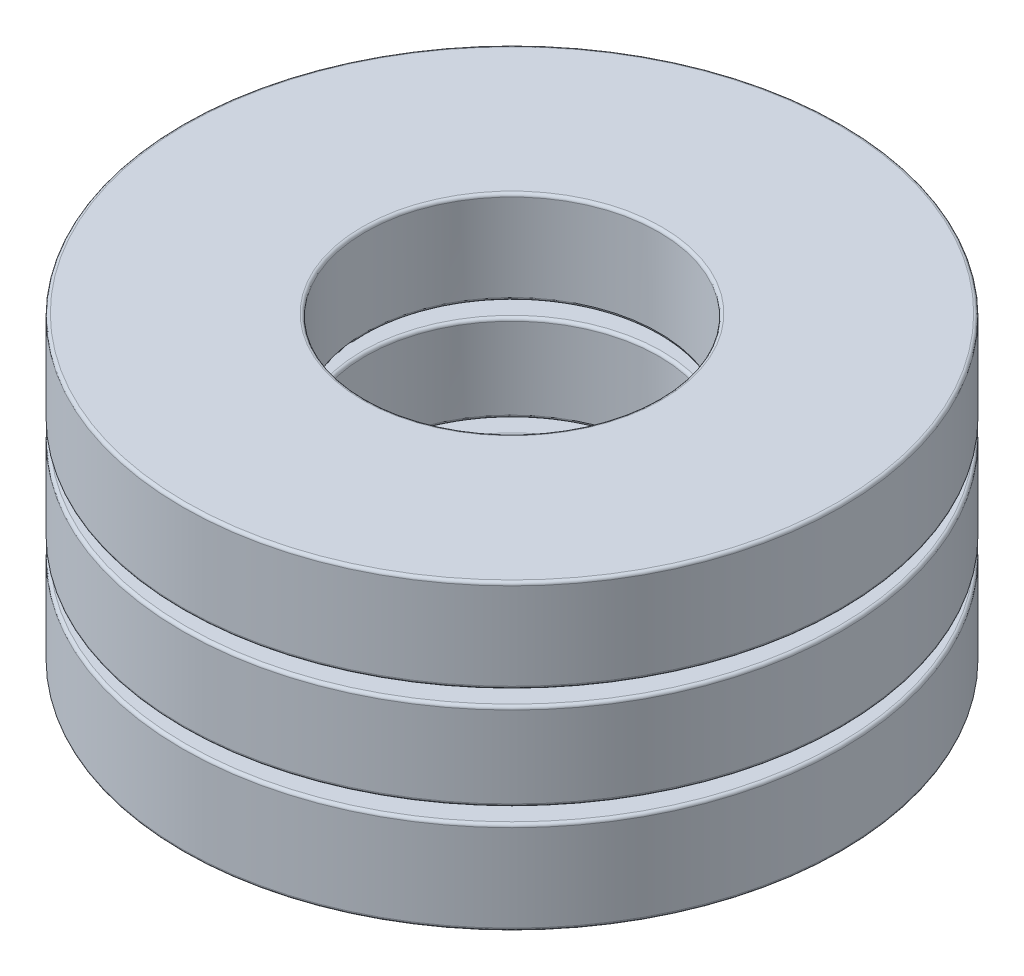
from build123d import *

# Parameters (mm, degrees)
SKETCH3_W         = 2.495
SKETCH3_H         = 1.1925
CIRPATTERN1_COUNT = 6
CIRPATTERN1_ANGLE = 300
CIRPATTERN2_COUNT = 6
SKETCH6_W         = 2.495
SKETCH6_H         = 1.27
FILLET1_R         = 0.0413
FILLET2_R         = 0.0413
FILLET3_R         = 0.0413


with BuildPart() as part:
    # Sketch3 → Revolve1 (revolve)
    with BuildSketch(Plane.XY, mode=Mode.PRIVATE) as revolve1_sk:
        with Locations((3.2525, 0)):
            Rectangle(SKETCH3_W, SKETCH3_H)
    revolve(revolve1_sk.sketch.rotate(Axis((0, 2.065, 0), (0, -1, 0)), 90), axis=Axis((0, 2.065, 0), (0, -1, 0)))

    # Sketch4 → Cut-Revolve1 (revolve, cut)
    with BuildSketch(Plane.XY):
        with BuildLine():
            Line((3.25, 0.795), (3.25, -0.795))
            ThreePointArc((3.25, -0.795), (2.455, 0), (3.25, 0.795))
        make_face()
    cut_revolve1 = revolve(axis=Axis((3.25, 0.795, 0), (0, -1, 0)), mode=Mode.SUBTRACT)

    # CirPattern2: Cut-Revolve1 ×6 about axis
    cirpattern2_axis = Axis((0, 0, 0), (0, 1, 0))
    for i in range(1, CIRPATTERN2_COUNT):
        add(cut_revolve1.rotate(cirpattern2_axis, i * 360 / CIRPATTERN2_COUNT), mode=Mode.SUBTRACT)

    # Fillet2
    fillet2_edges = [part.edges().sort_by_distance(p)[0] for p in [
        (3.775843073, 0.59625, 0),
        (3.775843073, -0.59625, 0),
        (1.887921537, 0.59625, 3.269976022),
        (1.887921537, -0.59625, 3.269976022),
        (-1.887921537, 0.59625, 3.269976022),
        (-1.887921537, -0.59625, 3.269976022),
        (-3.775843073, 0.59625, 0),
        (-3.775843073, -0.59625, 0),
        (-1.887921537, 0.59625, -3.269976022),
        (-1.887921537, -0.59625, -3.269976022),
        (1.887921537, 0.59625, -3.269976022),
        (1.887921537, -0.59625, -3.269976022),
        (0, 0.59625, -4.5),
        (0, 0.59625, -2.005),
        (0, -0.59625, -2.005),
        (0, -0.59625, -4.5),
    ]]
    fillet(fillet2_edges, radius=FILLET2_R)


with BuildPart() as body_2:
    # Sketch5 → Revolve2 (revolve)
    with BuildSketch(Plane.XY):
        with BuildLine():
            Line((3.25, 0.795), (3.25, -0.795))
            ThreePointArc((3.25, -0.795), (2.455, 0), (3.25, 0.795))
        make_face()
    revolve(axis=Axis((3.25, 0.795, 0), (0, -1, 0)))


with BuildPart() as cirpattern1_1:
    # CirPattern1: pattern copy
    add(body_2.part.rotate(Axis((0, 2.065, 0), (0, -1, 0)), 1 * CIRPATTERN1_ANGLE / (CIRPATTERN1_COUNT - 1)))


with BuildPart() as cirpattern1_2:
    # CirPattern1: pattern copy
    add(body_2.part.rotate(Axis((0, 2.065, 0), (0, -1, 0)), 2 * CIRPATTERN1_ANGLE / (CIRPATTERN1_COUNT - 1)))


with BuildPart() as cirpattern1_3:
    # CirPattern1: pattern copy
    add(body_2.part.rotate(Axis((0, 2.065, 0), (0, -1, 0)), 3 * CIRPATTERN1_ANGLE / (CIRPATTERN1_COUNT - 1)))


with BuildPart() as cirpattern1_4:
    # CirPattern1: pattern copy
    add(body_2.part.rotate(Axis((0, 2.065, 0), (0, -1, 0)), 4 * CIRPATTERN1_ANGLE / (CIRPATTERN1_COUNT - 1)))


with BuildPart() as cirpattern1_5:
    # CirPattern1: pattern copy
    add(body_2.part.rotate(Axis((0, 2.065, 0), (0, -1, 0)), 5 * CIRPATTERN1_ANGLE / (CIRPATTERN1_COUNT - 1)))


with BuildPart() as body_8:
    # Sketch6 → Revolve3 (revolve)
    with BuildSketch(Plane.XY, mode=Mode.PRIVATE) as revolve3_sk:
        with Locations((3.2525, 1.43)):
            Rectangle(SKETCH6_W, SKETCH6_H)
        with Locations((3.2525, -1.43)):
            Rectangle(SKETCH6_W, SKETCH6_H)
    revolve(revolve3_sk.sketch.rotate(Axis((0, 2.065, 0), (0, -1, 0)), 90), axis=Axis((0, 2.065, 0), (0, -1, 0)))

    # Fillet1
    fillet1_edges = [body_8.edges().sort_by_distance(p)[0] for p in [
        (0, 2.065, -4.5),
        (0, 2.065, -2.005),
        (0, 0.795, -2.005),
        (0, 0.795, -4.5),
    ]]
    fillet(fillet1_edges, radius=FILLET1_R)

    # Fillet3
    fillet3_edges = [body_8.edges().sort_by_distance(p)[0] for p in [
        (0, -0.795, -4.5),
        (0, -0.795, -2.005),
        (0, -2.065, -2.005),
        (0, -2.065, -4.5),
    ]]
    fillet(fillet3_edges, radius=FILLET3_R)


solid = Compound([part.part, body_2.part, cirpattern1_1.part, cirpattern1_2.part, cirpattern1_3.part, cirpattern1_4.part, cirpattern1_5.part, body_8.part])
